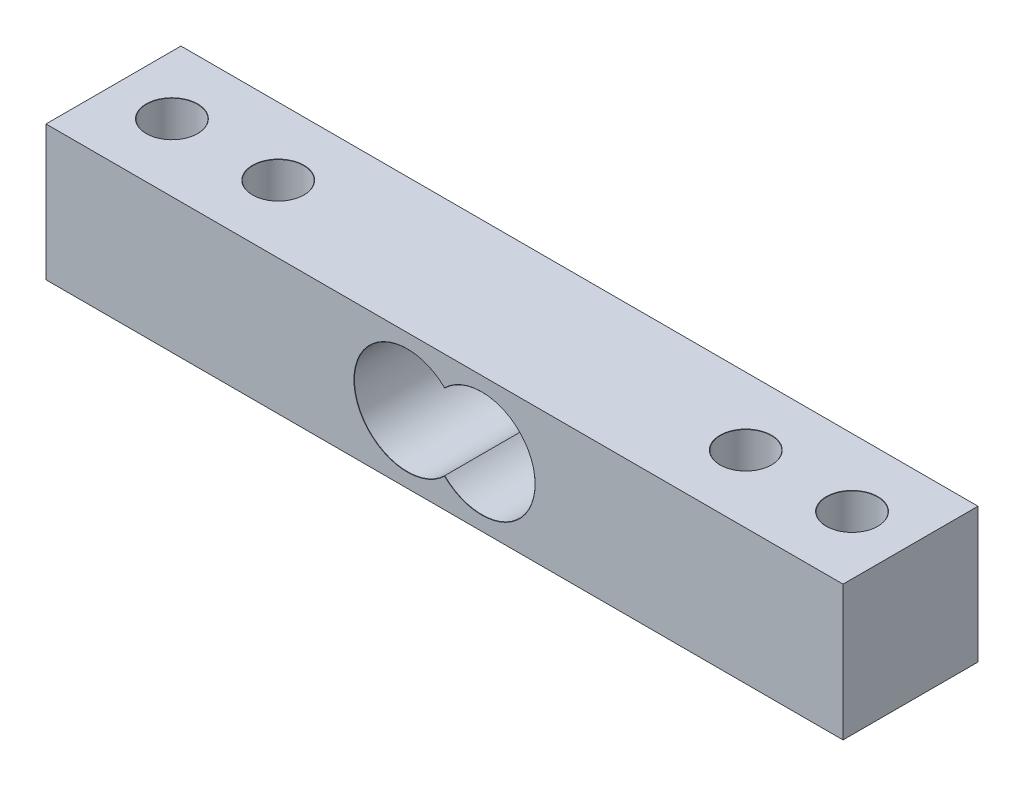
from build123d import *

# Parameters (mm, degrees)
SKETCH1_W                      = 75
SKETCH1_H                      = 12.7
BOSS_EXTRUDE1_DEPTH            = 12.7
M4_CLEARANCE_HOLE1_D           = 4.8
M4_CLEARANCE_HOLE1_CSINK_D     = 4.85
M4_CLEARANCE_HOLE1_CSINK_ANGLE = 100
M8_CLEARANCE_HOLE1_D           = 10
M8_CLEARANCE_HOLE1_CSINK_D     = 10.05
M8_CLEARANCE_HOLE1_CSINK_ANGLE = 100


with BuildPart() as part:
    # Sketch1 → Boss-Extrude1 (new body)
    with BuildSketch(Plane(origin=(0, 0, 0), x_dir=(1, 0, 0), z_dir=(0, 1, 0))):
        Rectangle(SKETCH1_W, SKETCH1_H)
    extrude(amount=BOSS_EXTRUDE1_DEPTH)

    # M4 Clearance Hole1 (through all)
    with Locations(Plane(origin=(0, 12.7, 0), x_dir=(1, 0, 0), z_dir=(0, 1, 0))):
        with Locations((-32, 0), (-22, 0), (22, 0), (32, 0)):
            CounterSinkHole(M4_CLEARANCE_HOLE1_D / 2, M4_CLEARANCE_HOLE1_CSINK_D / 2, counter_sink_angle=M4_CLEARANCE_HOLE1_CSINK_ANGLE)

    # M8 Clearance Hole1 (through all)
    with Locations(Plane.XY.offset(6.35)):
        with Locations((-3.5, 6.35), (3.5, 6.35)):
            CounterSinkHole(M8_CLEARANCE_HOLE1_D / 2, M8_CLEARANCE_HOLE1_CSINK_D / 2, counter_sink_angle=M8_CLEARANCE_HOLE1_CSINK_ANGLE)


solid = part.part
